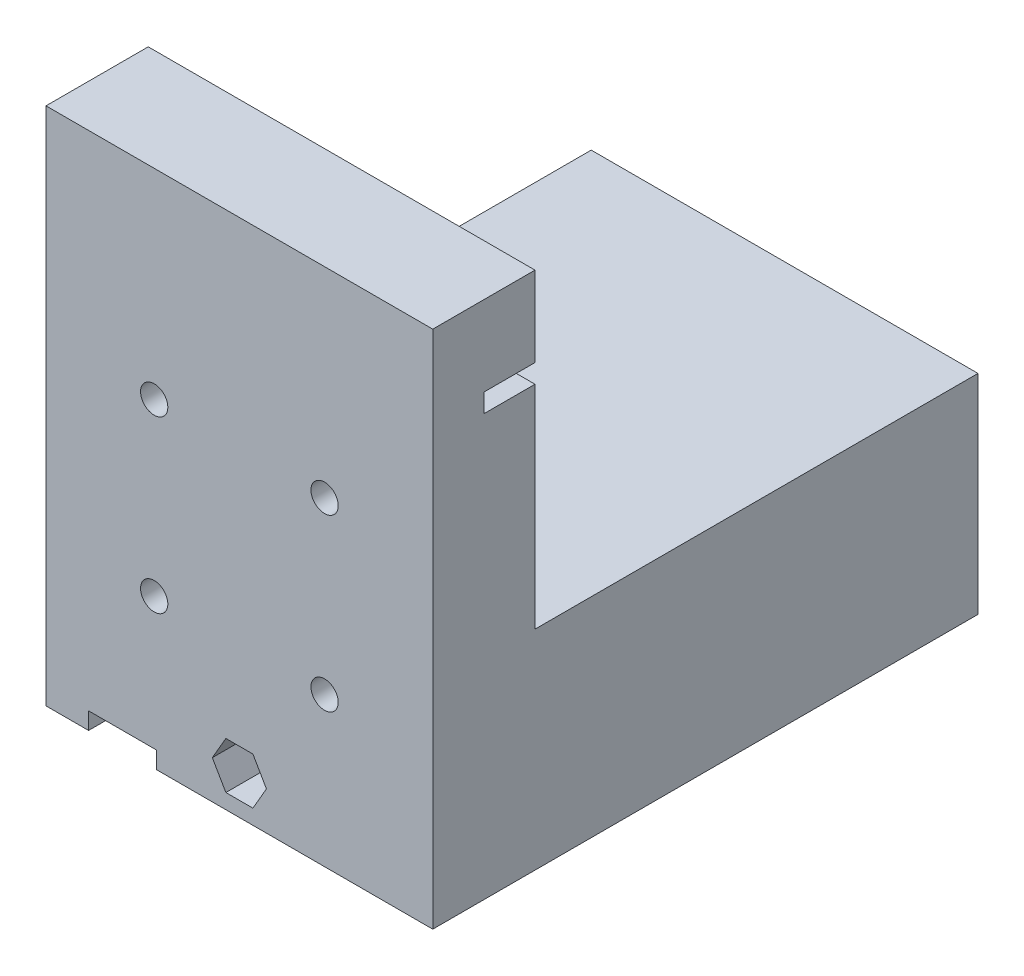
from build123d import *

# Parameters (mm, degrees)
SKETCH_1_W           = 45.4
SKETCH_1_H           = 27
EXTRUDE_1_DEPTH      = 7
SKETCH_2_R           = 1.6
CUT_EXTRUDE_1_DEPTH  = 62.727033531
SKETCH_4_R           = 3.1
EXTRUDE_2_DEPTH      = 5
SKETCH_5_W           = 45.4
SKETCH_5_H           = 12
EXTRUDE_3_DEPTH      = 20
SKETCH_7_R           = 5
CUT_EXTRUDE_3_DEPTH  = 6
EXTRUDE_4_DEPTH      = 14
SKETCH_10_W          = 8
SKETCH_10_H          = 12
CUT_EXTRUDE_6_DEPTH  = 2
SKETCH_12_R          = 2.2
CUT_EXTRUDE_8_DEPTH  = 6
SKETCH_13_R          = 2.2
CUT_EXTRUDE_9_DEPTH  = 6
SKETCH_14_W          = 45.4
SKETCH_14_H          = 24.5
SKETCH_14_R          = 3.1
EXTRUDE_5_DEPTH      = 52
SKETCH_15_W          = 12.5
SKETCH_15_H          = 36
CUT_EXTRUDE_10_DEPTH = 5
SKETCH_9_R           = 1.6
CUT_EXTRUDE_4_DEPTH  = 97.741548345
CUT_EXTRUDE_5_DEPTH  = 54.5
SKETCH_16_R          = 2.2
CUT_EXTRUDE_11_DEPTH = 6


with BuildPart() as part:
    # 草图1 → 凸台-拉伸1 (new body)
    with BuildSketch(Plane.XY):
        with Locations((-32.096319797, 14.04251269)):
            Rectangle(SKETCH_1_W, SKETCH_1_H)
    extrude(amount=EXTRUDE_1_DEPTH)

    # 草图2 → 切除-拉伸1 (cut, through all)
    with BuildSketch(Plane(origin=(0, 0, 0), x_dir=(-1, 0, 0), z_dir=(0, 0, -1))):
        with Locations((22.096319797, 24.04251269)):
            Circle(SKETCH_2_R)
        with Locations(Location((42.096319797, 24.04251269, 0), (0, 0, 180))):
            Circle(SKETCH_2_R)
        with Locations((42.096319797, 4.04251269)):
            Circle(SKETCH_2_R)
        with Locations(Location((22.096319797, 4.04251269, 0), (0, 0, 180))):
            Circle(SKETCH_2_R)
    extrude(amount=-CUT_EXTRUDE_1_DEPTH, mode=Mode.SUBTRACT)

    # 草图4 → 凸台-拉伸2 (add)
    with BuildSketch(Plane(origin=(0, 0, 0), x_dir=(-1, 0, 0), z_dir=(0, 0, -1))):
        Polygon((38.346319797, 0.54251269), (54.796319797, 0.54251269), (54.796319797, 27.54251269), (9.396319797, 27.54251269), (9.396319797, 0.54251269), (25.846319797, 0.54251269), align=None)
        with Locations(Location((42.096319797, 24.04251269, 0), (0, 0, 180))):
            Circle(SKETCH_4_R, mode=Mode.SUBTRACT)
        with Locations((22.096319797, 24.04251269)):
            Circle(SKETCH_4_R, mode=Mode.SUBTRACT)
        with Locations((42.096319797, 4.04251269)):
            Circle(SKETCH_4_R, mode=Mode.SUBTRACT)
        with Locations(Location((22.096319797, 4.04251269, 0), (0, 0, 180))):
            Circle(SKETCH_4_R, mode=Mode.SUBTRACT)
    extrude(amount=EXTRUDE_2_DEPTH)

    # 草图5 → 凸台-拉伸3 (add)
    with BuildSketch(Plane(origin=(0, 27.54251269, 0), x_dir=(1, 0, 0), z_dir=(0, 1, 0))):
        with Locations((-32.096319797, -1)):
            Rectangle(SKETCH_5_W, SKETCH_5_H)
    extrude(amount=EXTRUDE_3_DEPTH)

    # 草图7 → 切除-拉伸3 (cut)
    with BuildSketch(Plane(origin=(0, 0, -5), x_dir=(-1, 0, 0), z_dir=(0, 0, -1))):
        with BuildLine():
            Line((9.396319797, 38.14251269), (16.375464574, 38.14251269))
            ThreePointArc((16.375464574, 38.14251269), (18.004881648, 38.623584347), (19.111721141, 39.91251269))
            ThreePointArc((19.111721141, 39.91251269), (24.873653651, 44.014763896), (31.271319797, 40.998441785))
            ThreePointArc((31.271319797, 40.998441785), (32.096319797, 40.563574513), (32.921319797, 40.998441785))
            ThreePointArc((32.921319797, 40.998441785), (39.318985943, 44.014763896), (45.080918453, 39.91251269))
            ThreePointArc((45.080918453, 39.91251269), (46.187757946, 38.623584347), (47.81717502, 38.14251269))
            Line((47.81717502, 38.14251269), (54.796319797, 38.14251269))
            Line((54.796319797, 38.14251269), (54.796319797, 35.94251269))
            Line((54.796319797, 35.94251269), (47.81717502, 35.94251269))
            ThreePointArc((47.81717502, 35.94251269), (46.187757946, 35.461441034), (45.080918453, 34.17251269))
            ThreePointArc((45.080918453, 34.17251269), (39.318985943, 30.070261485), (32.921319797, 33.086583596))
            ThreePointArc((32.921319797, 33.086583596), (32.096319797, 33.521450868), (31.271319797, 33.086583596))
            ThreePointArc((31.271319797, 33.086583596), (24.873653651, 30.070261485), (19.111721141, 34.17251269))
            ThreePointArc((19.111721141, 34.17251269), (18.004881648, 35.461441034), (16.375464574, 35.94251269))
            Line((16.375464574, 35.94251269), (9.396319797, 35.94251269))
            Line((9.396319797, 35.94251269), (9.396319797, 38.14251269))
        make_face()
        with Locations((25.496319797, 37.04251269)):
            Circle(SKETCH_7_R, mode=Mode.SUBTRACT)
        with Locations(Location((38.696319797, 37.04251269, 0), (0, 0, 180))):
            Circle(SKETCH_7_R, mode=Mode.SUBTRACT)
    extrude(amount=-CUT_EXTRUDE_3_DEPTH, mode=Mode.SUBTRACT)

    # 草图8 → 凸台-拉伸4 (add)
    with BuildSketch(Plane.XZ.offset(-0.54251269)):
        Polygon((-54.796319797, 7), (-9.396319797, 7), (-9.396319797, -5), (-25.846319797, -5), (-38.346319797, -5), (-54.796319797, -5), align=None)
    extrude(amount=EXTRUDE_4_DEPTH)

    # 草图10 → 切除-拉伸6 (cut)
    with BuildSketch(Plane.XZ.offset(13.45748731)):
        with Locations((-45.796319797, 1)):
            Rectangle(SKETCH_10_W, SKETCH_10_H)
    extrude(amount=-CUT_EXTRUDE_6_DEPTH, mode=Mode.SUBTRACT)

    # 草图12 → 切除-拉伸8 (cut)
    with BuildSketch(Plane.XZ.offset(11.45748731)):
        with Locations(Location((-45.796319797, 1, 0), (0, 0, 270))):
            Circle(SKETCH_12_R)
    extrude(amount=-CUT_EXTRUDE_8_DEPTH, mode=Mode.SUBTRACT)

    # 草图13 → 切除-拉伸9 (cut)
    with BuildSketch(Plane(origin=(0, 0, -5), x_dir=(-1, 0, 0), z_dir=(0, 0, -1))):
        with Locations((32.096319797, 14.04251269)):
            Circle(SKETCH_13_R)
    extrude(amount=-CUT_EXTRUDE_9_DEPTH, mode=Mode.SUBTRACT)

    # 草图14 → 凸台-拉伸5 (add)
    with BuildSketch(Plane(origin=(0, 0, -5), x_dir=(-1, 0, 0), z_dir=(0, 0, -1))):
        with Locations((32.096319797, -1.20748731)):
            Rectangle(SKETCH_14_W, SKETCH_14_H)
        with Locations(Location((22.096319797, 4.04251269, 0), (0, 0, 180))):
            Circle(SKETCH_14_R, mode=Mode.SUBTRACT)
        with Locations((42.096319797, 4.04251269)):
            Circle(SKETCH_14_R, mode=Mode.SUBTRACT)
    extrude(amount=EXTRUDE_5_DEPTH)

    # 草图15 → 切除-拉伸10 (cut)
    with BuildSketch(Plane(origin=(0, 0, -57), x_dir=(-1, 0, 0), z_dir=(0, 0, -1))):
        with Locations((32.096319797, -13.45748731)):
            Rectangle(SKETCH_15_W, SKETCH_15_H)
    extrude(amount=-CUT_EXTRUDE_10_DEPTH, mode=Mode.SUBTRACT)

    # 草图9 → 切除-拉伸4 (cut, through all)
    with BuildSketch(Plane.XY.offset(7)):
        with Locations((-32.096319797, -8.95748731)):
            Circle(SKETCH_9_R)
    extrude(amount=-CUT_EXTRUDE_4_DEPTH, mode=Mode.SUBTRACT)

    # 草图3 → 切除-拉伸5 (cut)
    with BuildSketch(Plane.XY.offset(7)):
        Polygon((-28.920893316, -8.95748731), (-30.508606557, -6.20748731), (-33.684033037, -6.20748731), (-35.271746277, -8.95748731), (-33.684033037, -11.70748731), (-30.508606557, -11.70748731), align=None)
    extrude(amount=-CUT_EXTRUDE_5_DEPTH, mode=Mode.SUBTRACT)

    # 草图16 → 切除-拉伸11 (cut)
    with BuildSketch(Plane(origin=(0, 0, -57), x_dir=(-1, 0, 0), z_dir=(0, 0, -1))):
        with Locations((32.096319797, 8.04251269)):
            Circle(SKETCH_16_R)
    extrude(amount=-CUT_EXTRUDE_11_DEPTH, mode=Mode.SUBTRACT)


solid = part.part
